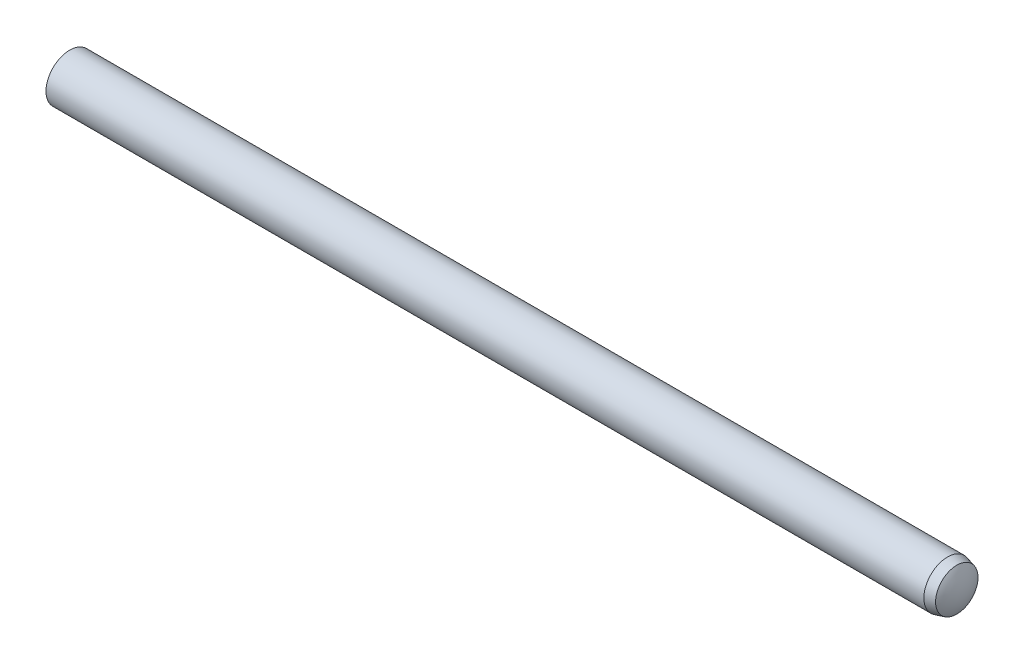
from build123d import *

# Parameters (mm, degrees)
EXTRUDE1_DEPTH      = 19
EXTRUDE1_DEPTH_BACK = 19
SKETCH2_R           = 1


with BuildPart() as part:
    # Sketch2 → Extrude1 (new, two sides: drawn at the far end of the back side and taken through both)
    with BuildSketch(Plane(origin=(0, 0, 0), x_dir=(0, 0, -1), z_dir=(1, 0, 0)).offset(-EXTRUDE1_DEPTH_BACK)):
        Circle(SKETCH2_R)
    extrude(amount=EXTRUDE1_DEPTH + EXTRUDE1_DEPTH_BACK)

    # Sketch5 → Cut-Revolve1 (revolve, cut)
    with BuildSketch(Plane.XY, mode=Mode.PRIVATE) as cut_revolve1_sk:
        with BuildLine():
            Line((18.35, 1), (18.35, 1.5))
            Line((18.35, 1.5), (19.5, 1.5))
            Line((19.5, 1.5), (19.5, 0))
            Line((19.5, 0), (19, 0))
            ThreePointArc((19, 0), (18.933685026, 0.46624026), (18.74, 0.895499815))
            Line((18.74, 0.895499815), (18.35, 1))
        make_face()
        with BuildLine():
            Line((-18.7, 1), (-18.7, 1.5))
            Line((-18.7, 1.5), (-19.5, 1.5))
            Line((-19.5, 1.5), (-19.5, 0))
            Line((-19.5, 0), (-19, 0))
            ThreePointArc((-19, 0), (-18.923384418, 0.522015325), (-18.7, 1))
        make_face()
    revolve(cut_revolve1_sk.sketch.rotate(Axis((-19, 0, 0), (1, 0, 0)), 90), axis=Axis((-19, 0, 0), (1, 0, 0)), mode=Mode.SUBTRACT)


solid = part.part
